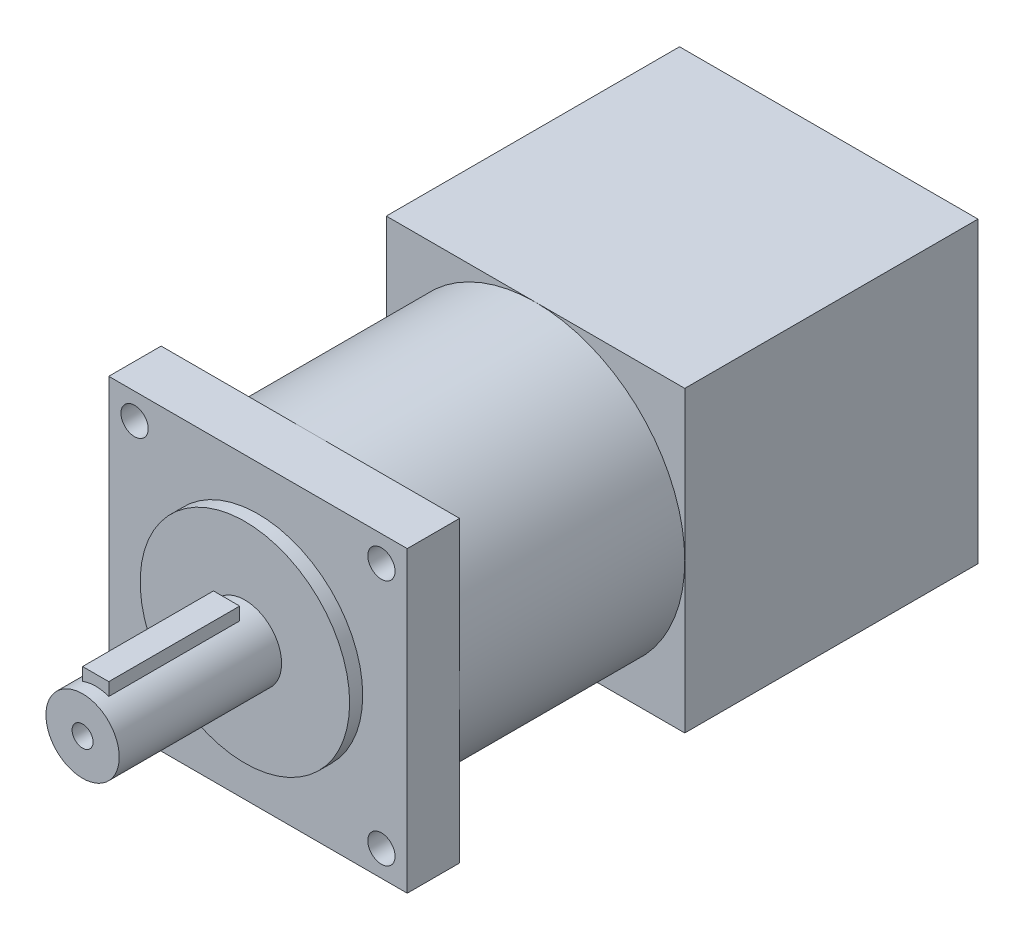
from build123d import *

# Parameters (mm, degrees)
SKETCH_1_W          = 57
SKETCH_1_H          = 57
EXTRUDE_1_DEPTH     = 56
SKETCH_2_R          = 28.5
EXTRUDE_2_DEPTH     = 53
SKETCH_3_R          = 20
EXTRUDE_3_DEPTH     = 2.5
SKETCH_4_R          = 7
EXTRUDE_4_DEPTH     = 31
SKETCH_7_W          = 57
SKETCH_7_H          = 57
SKETCH_7_R          = 2.6
EXTRUDE_5_DEPTH     = 10
SKETCH_8_W          = 5
SKETCH_8_H          = 4
EXTRUDE_6_DEPTH     = 25
SKETCH_9_R          = 2
CUT_EXTRUDE_1_DEPTH = 6


with BuildPart() as part:
    # 草图1 → 凸台-拉伸1 (new body)
    with BuildSketch(Plane.XY):
        Rectangle(SKETCH_1_W, SKETCH_1_H)
    extrude(amount=EXTRUDE_1_DEPTH)

    # 草图2 → 凸台-拉伸2 (add)
    with BuildSketch(Plane.XY.offset(56)):
        Circle(SKETCH_2_R)
    extrude(amount=EXTRUDE_2_DEPTH)

    # 草图3 → 凸台-拉伸3 (add)
    with BuildSketch(Plane.XY.offset(109)):
        Circle(SKETCH_3_R)
    extrude(amount=EXTRUDE_3_DEPTH)

    # 草图4 → 凸台-拉伸4 (add)
    with BuildSketch(Plane.XY.offset(111.5)):
        Circle(SKETCH_4_R)
    extrude(amount=EXTRUDE_4_DEPTH)

    # 草图7 → 凸台-拉伸5 (add)
    with BuildSketch(Plane.XY.offset(109)):
        Rectangle(SKETCH_7_W, SKETCH_7_H)
        with Locations((-23.57, 23.57)):
            Circle(SKETCH_7_R, mode=Mode.SUBTRACT)
        with Locations((23.57, 23.57)):
            Circle(SKETCH_7_R, mode=Mode.SUBTRACT)
        with Locations((23.57, -23.57)):
            Circle(SKETCH_7_R, mode=Mode.SUBTRACT)
        with Locations((-23.57, -23.57)):
            Circle(SKETCH_7_R, mode=Mode.SUBTRACT)
    extrude(amount=-EXTRUDE_5_DEPTH)

    # 草图8 → 凸台-拉伸6 (add)
    with BuildSketch(Plane.XY.offset(140)):
        with Locations((0, 7)):
            Rectangle(SKETCH_8_W, SKETCH_8_H)
    extrude(amount=-EXTRUDE_6_DEPTH)

    # 草图9 → 切除-拉伸1 (cut)
    with BuildSketch(Plane.XY.offset(142.5)):
        Circle(SKETCH_9_R)
    extrude(amount=-CUT_EXTRUDE_1_DEPTH, mode=Mode.SUBTRACT)


solid = part.part
